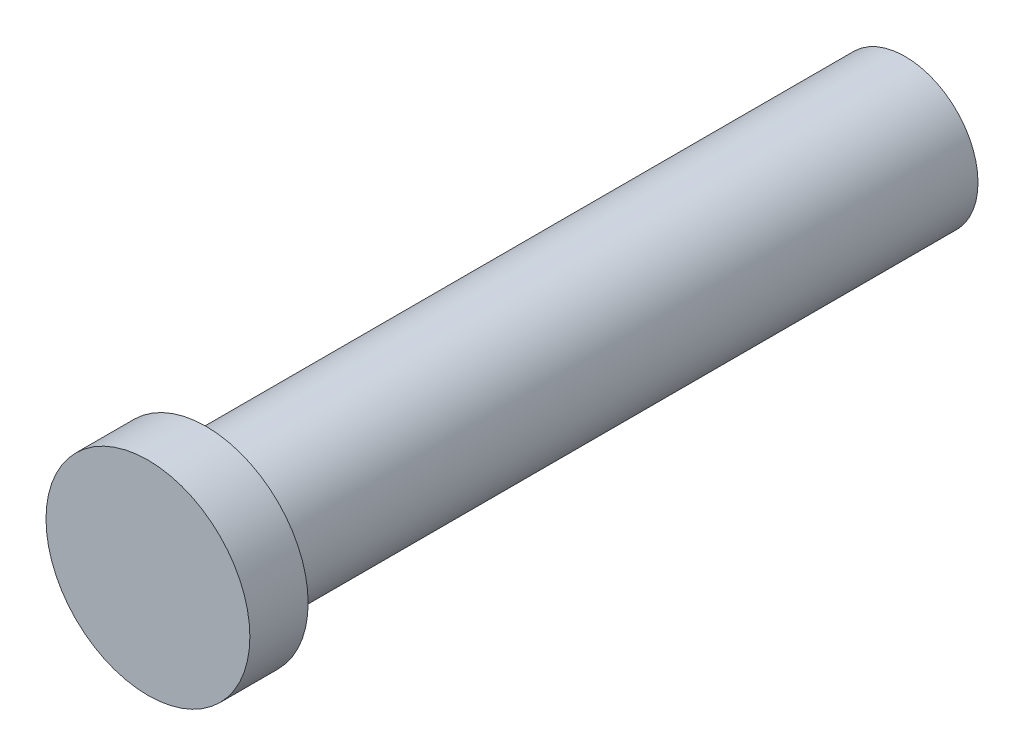
from build123d import *

# Parameters (mm, degrees)
SKETCH1_R           = 1.25
BOSS_EXTRUDE1_DEPTH = 12
SKETCH2_R           = 1.75
BOSS_EXTRUDE2_DEPTH = 1
SKETCH3_R           = 0.75
CUT_EXTRUDE1_DEPTH  = 3


with BuildPart() as part:
    # Sketch1 → Boss-Extrude1 (new body)
    with BuildSketch(Plane.XY):
        Circle(SKETCH1_R)
    extrude(amount=BOSS_EXTRUDE1_DEPTH)

    # Sketch2 → Boss-Extrude2 (add)
    with BuildSketch(Plane.XY.offset(12)):
        Circle(SKETCH2_R)
    extrude(amount=BOSS_EXTRUDE2_DEPTH)

    # Sketch3 → Cut-Extrude1 (cut)
    with BuildSketch(Plane(origin=(0, 0, 0), x_dir=(-1, 0, 0), z_dir=(0, 0, -1))):
        Circle(SKETCH3_R)
    extrude(amount=-CUT_EXTRUDE1_DEPTH, mode=Mode.SUBTRACT)


solid = part.part
